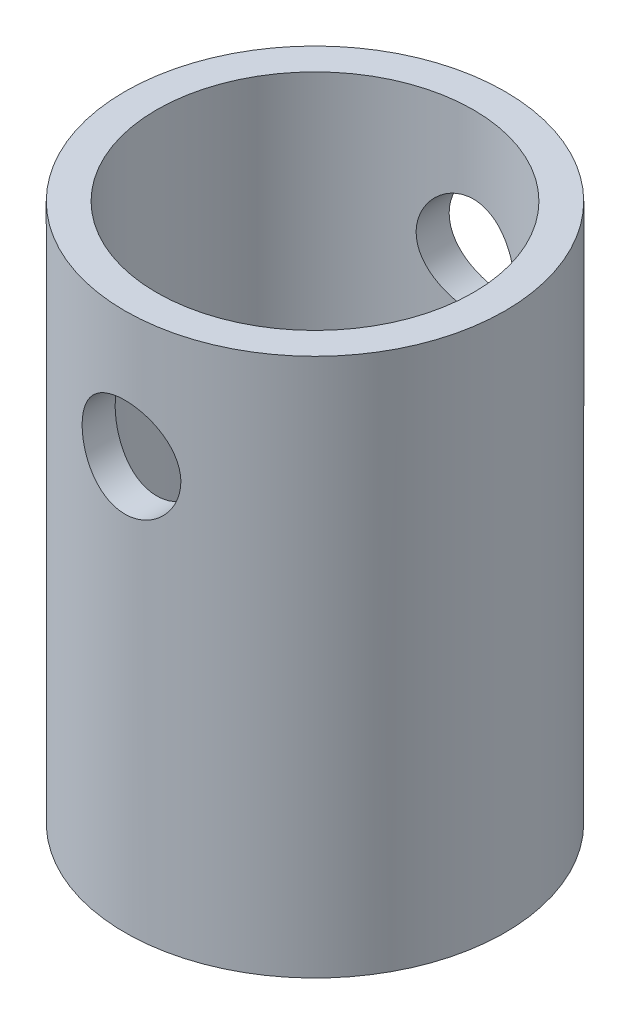
from build123d import *

# Parameters (mm, degrees)
SKETCH1_R                   = 38.1
SKETCH1_R_2                 = 31.75
BOSS_EXTRUDE1_DEPTH         = 101.6
BOSS_EXTRUDE2_START         = 6.35
SKETCH2_R                   = 38.1
BOSS_EXTRUDE2_DEPTH         = 6.35
F_3_8_24_TAPPED_HOLE1_D     = 8.4328
F_3_8_24_TAPPED_HOLE1_DEPTH = 22.352
F_3_8_24_TAPPED_HOLE1_TIP   = 2.533468714
CUT_EXTRUDE1_DEPTH          = 116.003391254
CUT_EXTRUDE1_DEPTH_BACK     = 116.003391254
SKETCH8_R                   = 9.896133373


with BuildPart() as part:
    # Sketch1 → Boss-Extrude1 (new body)
    with BuildSketch(Plane(origin=(0, 0, 0), x_dir=(1, 0, 0), z_dir=(0, 1, 0))):
        with Locations(Location((0, 0, 0), (0, 0, 270))):
            Circle(SKETCH1_R)
        with Locations(Location((0, 0, 0), (0, 0, 270))):
            Circle(SKETCH1_R_2, mode=Mode.SUBTRACT)
    extrude(amount=BOSS_EXTRUDE1_DEPTH)

    # Sketch2 → Boss-Extrude2 (add)
    with BuildSketch(Plane.XZ.offset(BOSS_EXTRUDE2_START)):
        with Locations(Location((0, 0, 0), (0, 0, 270))):
            Circle(SKETCH2_R)
    extrude(amount=-BOSS_EXTRUDE2_DEPTH)

    # 3/8-24 Tapped Hole1
    with Locations(Plane(origin=(0, -6.35, 0), x_dir=(-1, 0, 0), z_dir=(0, -1, 0))):
        with Locations((0, -19.05), (19.05, 0), (0, 19.05), (-19.05, 0)):
            Hole(F_3_8_24_TAPPED_HOLE1_D / 2, depth=F_3_8_24_TAPPED_HOLE1_DEPTH)
            with Locations((0, 0, -(F_3_8_24_TAPPED_HOLE1_DEPTH + F_3_8_24_TAPPED_HOLE1_TIP / 2))):  # 118° drill point
                Cone(0, F_3_8_24_TAPPED_HOLE1_D / 2, F_3_8_24_TAPPED_HOLE1_TIP, mode=Mode.SUBTRACT)

    # Sketch8 → Cut-Extrude1 (cut, two sides: drawn at the far end of the back side and taken through both)
    with BuildSketch(Plane.XY.offset(-CUT_EXTRUDE1_DEPTH_BACK)):
        with Locations((0, 76.2)):
            Circle(SKETCH8_R)
    extrude(amount=CUT_EXTRUDE1_DEPTH + CUT_EXTRUDE1_DEPTH_BACK, mode=Mode.SUBTRACT)


solid = part.part
